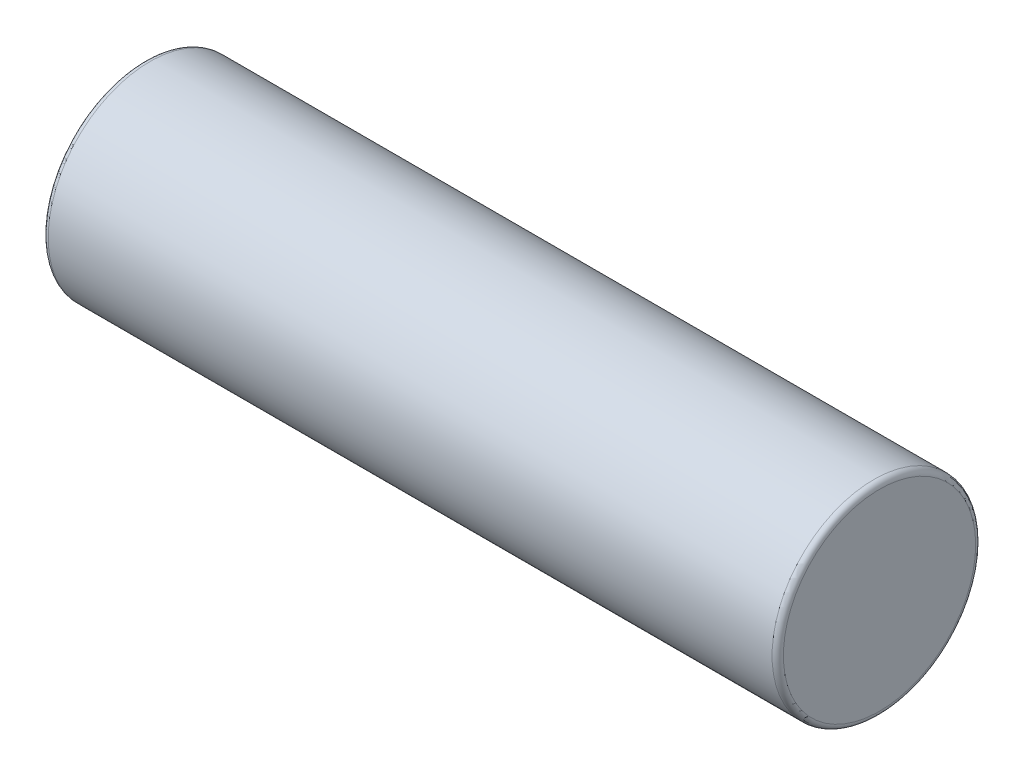
from build123d import *

# Parameters (mm, degrees)
SKETCH_2_R      = 9
EXTRUDE_1_DEPTH = 65
FILLET_1_R      = 0.5


with BuildPart() as part:
    # Эскиз2 → Бобышка-Вытянуть1 (new body)
    with BuildSketch(Plane(origin=(0, 0, 0), x_dir=(0, 0, -1), z_dir=(1, 0, 0))):
        Circle(SKETCH_2_R)
    extrude(amount=-EXTRUDE_1_DEPTH)

    # Скругление1
    fillet_1_edges = [part.edges().sort_by_distance(p)[0] for p in [
        (0, 0, 9),
        (-65, 0, 9),
    ]]
    fillet(fillet_1_edges, radius=FILLET_1_R)


solid = part.part
